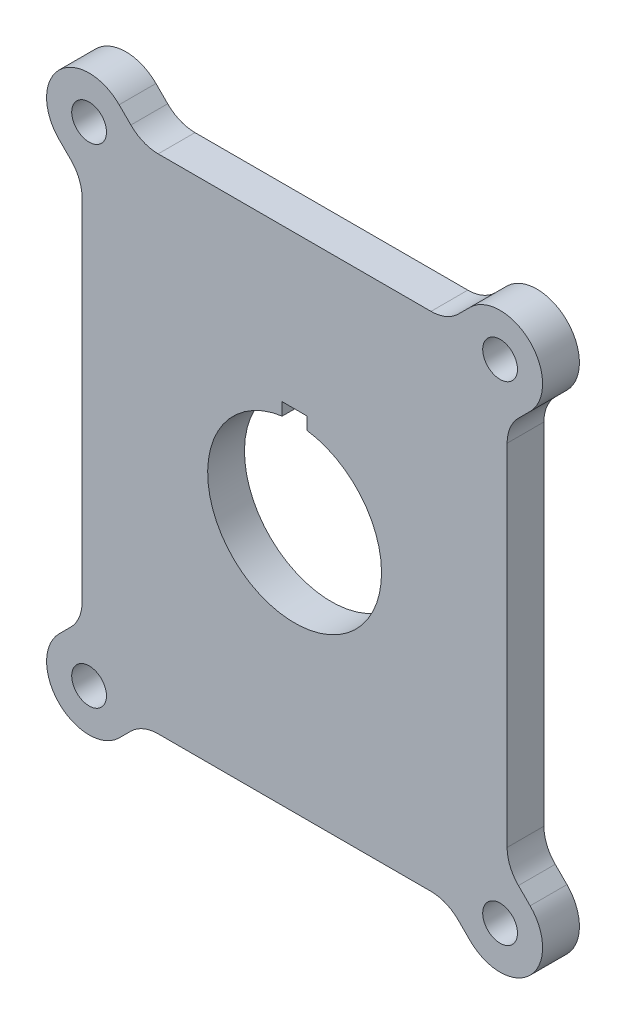
from build123d import *

# Parameters (mm, degrees)
BOSS_EXTRUDE1_DEPTH  = 4.7625
M4_CLEARANCE_HOLE2_D = 4.5


with BuildPart() as part:
    # Sketch4 → Boss-Extrude1 (new body)
    with BuildSketch(Plane.XY.offset(-59.668926648)):
        with BuildLine():
            Line((14.401994847, 48.710959692), (-20.899520343, 48.710959692))
            ThreePointArc((-20.899520343, 48.710959692), (-22.812937505, 49.091562029), (-24.435054249, 50.175425786))
            Line((-24.435054249, 50.175425786), (-25.951045701, 51.691417238))
            ThreePointArc((-25.951045701, 51.691417238), (-33.729220295, 51.691417238), (-33.729220295, 43.913242645))
            Line((-33.729220295, 43.913242645), (-32.213228842, 42.397251193))
            ThreePointArc((-32.213228842, 42.397251193), (-31.129365086, 40.775134449), (-30.748762748, 38.861717287))
            Line((-30.748762748, 38.861717287), (-30.748762748, -6.439797903))
            ThreePointArc((-30.748762748, -6.439797903), (-31.129365086, -8.353215065), (-32.213228842, -9.975331809))
            Line((-32.213228842, -9.975331809), (-33.729220295, -11.491323262))
            ThreePointArc((-33.729220295, -11.491323262), (-33.729220295, -19.269497855), (-25.951045701, -19.269497855))
            Line((-25.951045701, -19.269497855), (-24.435054249, -17.753506402))
            ThreePointArc((-24.435054249, -17.753506402), (-22.812937505, -16.669642646), (-20.899520343, -16.289040308))
            Line((-20.899520343, -16.289040308), (14.401994847, -16.289040308))
            ThreePointArc((14.401994847, -16.289040308), (16.315412009, -16.669642646), (17.937528753, -17.753506402))
            Line((17.937528753, -17.753506402), (19.453520205, -19.269497855))
            ThreePointArc((19.453520205, -19.269497855), (27.231694798, -19.269497855), (27.231694798, -11.491323262))
            Line((27.231694798, -11.491323262), (25.715703346, -9.975331809))
            ThreePointArc((25.715703346, -9.975331809), (24.631839589, -8.353215065), (24.251237252, -6.439797903))
            Line((24.251237252, -6.439797903), (24.251237252, 38.861717287))
            ThreePointArc((24.251237252, 38.861717287), (24.631839589, 40.775134449), (25.715703346, 42.397251193))
            Line((25.715703346, 42.397251193), (27.231694798, 43.913242645))
            ThreePointArc((27.231694798, 43.913242645), (27.231694798, 51.691417238), (19.453520205, 51.691417238))
            Line((19.453520205, 51.691417238), (17.937528753, 50.175425786))
            ThreePointArc((17.937528753, 50.175425786), (16.315412009, 49.091562029), (14.401994847, 48.710959692))
        make_face()
        with BuildLine():
            Line((-1.648762748, 27.34660067), (-1.648762748, 28.960959692))
            Line((-1.648762748, 28.960959692), (-4.848762748, 28.960959692))
            Line((-4.848762748, 28.960959692), (-4.848762748, 27.34660067))
            ThreePointArc((-4.848762748, 27.34660067), (-3.248762748, 4.960959692), (-1.648762748, 27.34660067))
        make_face(mode=Mode.SUBTRACT)
    extrude(amount=BOSS_EXTRUDE1_DEPTH)

    # M4 Clearance Hole2 (through all)
    with Locations(Plane.XY.offset(-54.906426648)):
        with Locations((-29.840132998, 47.802329941), (23.342607502, 47.802329941), (23.342607502, -15.380410558), (-29.840132998, -15.380410558)):
            Hole(M4_CLEARANCE_HOLE2_D / 2)


solid = part.part
